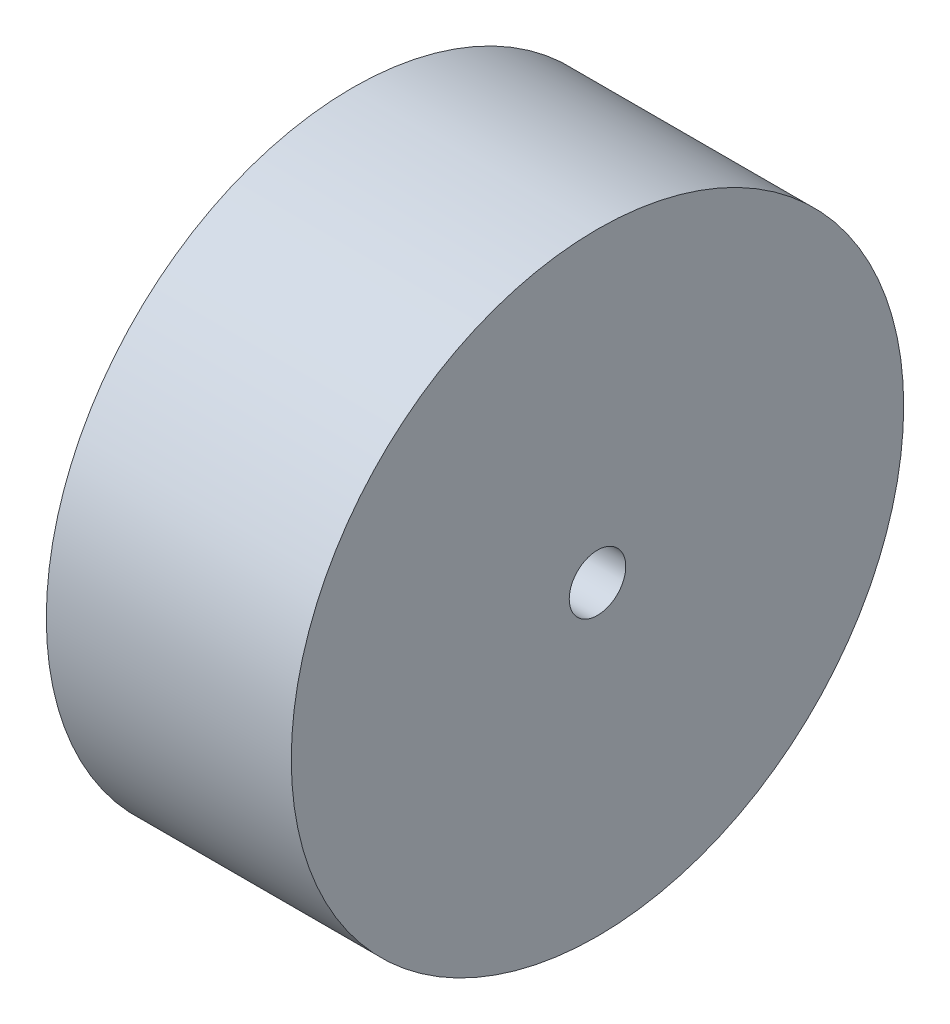
from build123d import *

# Parameters (mm, degrees)
SKETCH_1_R      = 32.5
SKETCH_1_R_2    = 3
EXTRUDE_1_DEPTH = 26


with BuildPart() as part:
    # 草图1 → 凸台-拉伸1 (new body)
    with BuildSketch(Plane(origin=(0, 0, 0), x_dir=(0, 0, -1), z_dir=(1, 0, 0))):
        with Locations(Location((0, 0, 0), (0, 0, 180))):
            Circle(SKETCH_1_R)
        with Locations(Location((0, 0, 0), (0, 0, 180))):
            Circle(SKETCH_1_R_2, mode=Mode.SUBTRACT)
    extrude(amount=EXTRUDE_1_DEPTH)


solid = part.part
